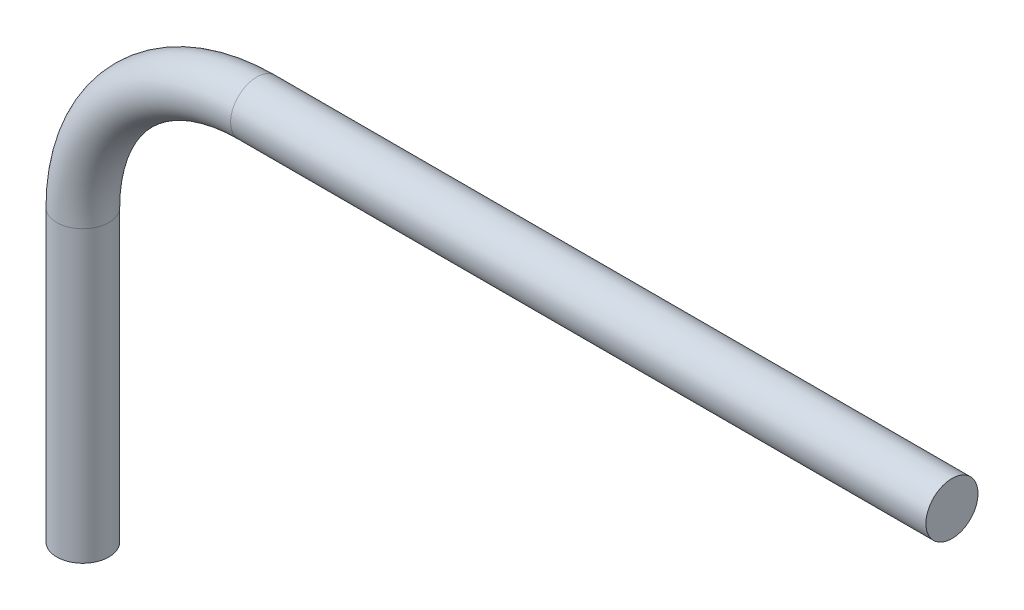
from build123d import *

# Parameters (mm, degrees)
SWEEP1_PROFILE_R = 4.5


with BuildPart() as part:
    # Sweep1: sweep along a path in Sketch1
    with BuildLine(Plane.XY) as sweep1_path:
        Line((0, 0), (0, 50))
        ThreePointArc((0, 50), (8.786796564, 71.213203436), (30, 80))
        Line((30, 80), (150, 80))
    # Sweep1 profile (on start of the path) → Sweep1 (sweep)
    with BuildSketch(Plane.ZX):
        Circle(SWEEP1_PROFILE_R)
    sweep(path=sweep1_path.line)


solid = part.part
